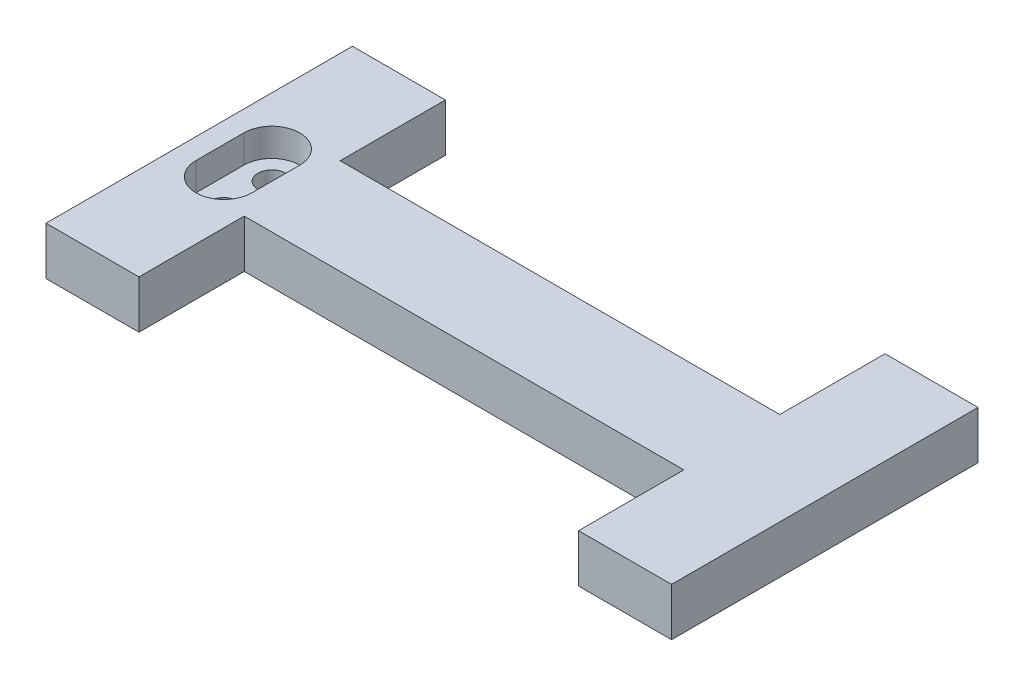
from build123d import *

# Parameters (mm, degrees)
BOSS_EXTRUDE1_DEPTH = 6
CUT_EXTRUDE2_DEPTH  = 3.5
SKETCH5_R           = 1.75
CUT_EXTRUDE3_DEPTH  = 4


with BuildPart() as part:
    # Sketch2 → Boss-Extrude1 (new body)
    with BuildSketch(Plane(origin=(0, 0, 0), x_dir=(1, 0, 0), z_dir=(0, 1, 0))):
        Polygon((-27.5, -6), (-27.5, 6), (-27.5, 19.170673077), (-39.134615385, 19.170673077), (-39.134615385, -19.170673077), (-27.5, -19.170673077), align=None)
        Polygon((0, -6), (0, 0), (0, 6), (-27.5, 6), (-27.5, -6), align=None)
        Polygon((0, 6), (0, 0), (0, -6), (27.5, -6), (27.5, 6), align=None)
        Polygon((27.5, 19.170673077), (27.5, 6), (27.5, -6), (27.5, -19.170673077), (39.134615385, -19.170673077), (39.134615385, 19.170673077), align=None)
    extrude(amount=BOSS_EXTRUDE1_DEPTH)

    # Sketch3 → Cut-Extrude2 (cut)
    with BuildSketch(Plane(origin=(0, 6, 0), x_dir=(1, 0, 0), z_dir=(0, 1, 0))):
        with BuildLine():
            Line((-29.544200918, 3), (-29.544200918, -3))
            ThreePointArc((-29.544200918, -3), (-33.044200918, -6.5), (-36.544200918, -3))
            Line((-36.544200918, -3), (-36.544200918, 3))
            ThreePointArc((-36.544200918, 3), (-33.044200918, 6.5), (-29.544200918, 3))
        make_face()
    extrude(amount=-CUT_EXTRUDE2_DEPTH, mode=Mode.SUBTRACT)

    # Sketch5 → Cut-Extrude3 (cut)
    with BuildSketch(Plane(origin=(0, 2.5, 0), x_dir=(1, 0, 0), z_dir=(0, 1, 0))):
        with Locations(Location((-33.044200918, 3, 0), (0, 0, 270))):
            Circle(SKETCH5_R)
        with Locations(Location((-33.044200918, -3, 0), (0, 0, 270))):
            Circle(SKETCH5_R)
    extrude(amount=-CUT_EXTRUDE3_DEPTH, mode=Mode.SUBTRACT)


solid = part.part
